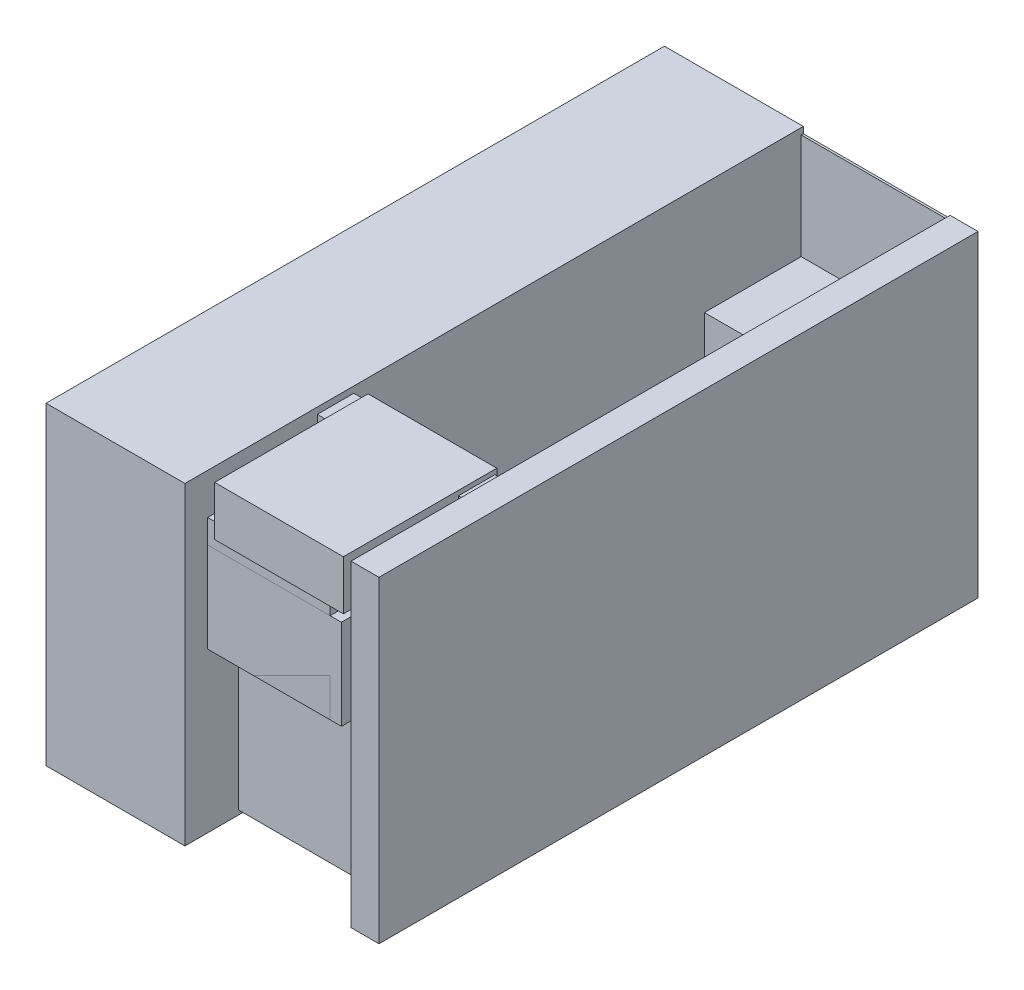
from build123d import *

# Parameters (mm, degrees)
SCHIZZO1_W                        = 700
SCHIZZO1_H                        = 700
ESTRUSIONE_ESTRUSIONE1_DEPTH      = 1130
SCHIZZO2_W                        = 330
SCHIZZO2_H                        = 265
ESTRUSIONE_ESTRUSIONE2_DEPTH      = 255
SCHIZZO3_W                        = 150
SCHIZZO3_H                        = 95
ESTRUSIONE_ESTRUSIONE3_DEPTH      = 210
SCHIZZO5_W                        = 350
SCHIZZO5_H                        = 1040
TAGLIO_ESTRUSIONE1_DEPTH          = 245
SCHIZZO7_W                        = 350
SCHIZZO7_H                        = 465
TAGLIO_ESTRUSIONE2_DEPTH          = 95
SCHIZZO8_W                        = 350
SCHIZZO8_H                        = 350
TAGLIO_ESTRUSIONE3_DEPTH          = 458
SCHIZZO9_W                        = 290
SCHIZZO9_H                        = 225
TAGLIO_ESTRUSIONE5_DEPTH          = 320
ESTRUSIONE_ESTRUSIONE5_DEPTH      = 18
ESTRUSIONE_ESTRUSIONE5_DEPTH_BACK = 305
SCHIZZO10_W                       = 1437.610772049
SCHIZZO10_H                       = 729.839733265
ESTRUSIONE_ESTRUSIONE6_DEPTH      = 11
ESTRUSIONE_ESTRUSIONE6_DEPTH_BACK = 54
SCHIZZO11_W                       = 1392.524009873
SCHIZZO11_H                       = 737.915681111
ESTRUSIONE_ESTRUSIONE7_DEPTH      = 11
ESTRUSIONE_ESTRUSIONE7_DEPTH_BACK = 104
SCHIZZO12_W                       = 299.349754516
SCHIZZO12_H                       = 356.648974915
SCHIZZO15_W                       = 311.967933214
SCHIZZO15_H                       = 209.587453761
ESTRUSIONE_ESTRUSIONE9_DEPTH      = 38
SCHIZZO18_W                       = 282.631025558
SCHIZZO18_H                       = 479.986147738
ESTRUSIONE_ESTRUSIONE11_DEPTH     = 375
SCHIZZO19_W                       = 279.763490261
SCHIZZO19_H                       = 367.953434119
ESTRUSIONE_ESTRUSIONE12_DEPTH     = 287


with BuildPart() as part:
    # Schizzo1 → Estrusione-Estrusione1 (new body)
    with BuildSketch(Plane.XY):
        Rectangle(SCHIZZO1_W, SCHIZZO1_H)
    extrude(amount=ESTRUSIONE_ESTRUSIONE1_DEPTH)

    # Schizzo5 → Taglio-Estrusione1 (cut)
    with BuildSketch(Plane(origin=(0, 350, 0), x_dir=(1, 0, 0), z_dir=(0, 1, 0))):
        with Locations((125, -525)):
            Rectangle(SCHIZZO5_W, SCHIZZO5_H)
    extrude(amount=-TAGLIO_ESTRUSIONE1_DEPTH, mode=Mode.SUBTRACT)

    # Schizzo7 → Taglio-Estrusione2 (cut)
    with BuildSketch(Plane(origin=(0, 105, 0), x_dir=(1, 0, 0), z_dir=(0, 1, 0))):
        with Locations((125, -462.5)):
            Rectangle(SCHIZZO7_W, SCHIZZO7_H)
    extrude(amount=-TAGLIO_ESTRUSIONE2_DEPTH, mode=Mode.SUBTRACT)

    # Schizzo8 → Taglio-Estrusione3 (cut)
    with BuildSketch(Plane(origin=(0, 105, 0), x_dir=(1, 0, 0), z_dir=(0, 1, 0))):
        with Locations((125, -870)):
            Rectangle(SCHIZZO8_W, SCHIZZO8_H)
    extrude(amount=-TAGLIO_ESTRUSIONE3_DEPTH, mode=Mode.SUBTRACT)


with BuildPart() as body_2:
    # Schizzo2 → Estrusione-Estrusione2 (new body)
    with BuildSketch(Plane.XY.offset(1130)):
        with Locations((75, 137.5)):
            Rectangle(SCHIZZO2_W, SCHIZZO2_H)
    extrude(amount=ESTRUSIONE_ESTRUSIONE2_DEPTH)


with BuildPart() as body_3:
    # Schizzo3 → Estrusione-Estrusione3 (new body)
    with BuildSketch(Plane.XY.offset(1130)):
        with Locations((-165, 147.5)):
            Rectangle(SCHIZZO3_W, SCHIZZO3_H)
    extrude(amount=ESTRUSIONE_ESTRUSIONE3_DEPTH)


with BuildPart() as taglio_estrusione5_tool:
    # Schizzo9 → Taglio-Estrusione5 (new body)
    with BuildSketch(Plane(origin=(0, 0, 1045), x_dir=(-1, 0, 0), z_dir=(0, 0, -1))):
        with Locations((-75, 137.5)):
            Rectangle(SCHIZZO9_W, SCHIZZO9_H)
    extrude(amount=-TAGLIO_ESTRUSIONE5_DEPTH)


with BuildPart() as part_1:
    add(part.part)

    # Taglio-Estrusione5: cut by taglio_estrusione5_tool
    add(taglio_estrusione5_tool.part, mode=Mode.SUBTRACT)


with BuildPart() as body_2_1:
    add(body_2.part)

    # Taglio-Estrusione5: cut by taglio_estrusione5_tool
    add(taglio_estrusione5_tool.part, mode=Mode.SUBTRACT)


with BuildPart() as body_4:
    # Schizzo10 → Estrusione-Estrusione5 (new, two sides: drawn at the far end of the back side and taken through both)
    with BuildSketch(Plane.ZY.offset(350).offset(-ESTRUSIONE_ESTRUSIONE5_DEPTH_BACK)):
        with Locations((718.805386025, -0.185507772)):
            Rectangle(SCHIZZO10_W, SCHIZZO10_H)
    extrude(amount=ESTRUSIONE_ESTRUSIONE5_DEPTH + ESTRUSIONE_ESTRUSIONE5_DEPTH_BACK)


with BuildPart() as body_5:
    # Schizzo11 → Estrusione-Estrusione6 (new, two sides: drawn at the far end of the back side and taken through both)
    with BuildSketch(Plane(origin=(350, 0, 0), x_dir=(0, 0, -1), z_dir=(1, 0, 0)).offset(-ESTRUSIONE_ESTRUSIONE6_DEPTH_BACK)):
        with Locations((-696.262004937, -12.690818359)):
            Rectangle(SCHIZZO11_W, SCHIZZO11_H)
    extrude(amount=ESTRUSIONE_ESTRUSIONE6_DEPTH + ESTRUSIONE_ESTRUSIONE6_DEPTH_BACK)


with BuildPart() as body_6:
    # Schizzo12 → Estrusione-Estrusione7 (new, two sides: drawn at the far end of the back side and taken through both)
    with BuildSketch(Plane(origin=(0, 350, 0), x_dir=(1, 0, 0), z_dir=(0, 1, 0)).offset(-ESTRUSIONE_ESTRUSIONE7_DEPTH_BACK)):
        with Locations((133.312866105, -1218.98054727)):
            Rectangle(SCHIZZO12_W, SCHIZZO12_H)
    extrude(amount=ESTRUSIONE_ESTRUSIONE7_DEPTH + ESTRUSIONE_ESTRUSIONE7_DEPTH_BACK)


with BuildPart() as body_7:
    # Schizzo15 → Estrusione-Estrusione9 (new body)
    with BuildSketch(Plane.XY.offset(1385)):
        with Locations((110.12024335, 109.793726881)):
            Rectangle(SCHIZZO15_W, SCHIZZO15_H)
    extrude(amount=-ESTRUSIONE_ESTRUSIONE9_DEPTH)


with BuildPart() as body_8:
    # Schizzo18 → Estrusione-Estrusione11 (new body)
    with BuildSketch(Plane(origin=(0, 10, 0), x_dir=(1, 0, 0), z_dir=(0, 1, 0))):
        with Locations((141.315512779, -469.993073869)):
            Rectangle(SCHIZZO18_W, SCHIZZO18_H)
    extrude(amount=-ESTRUSIONE_ESTRUSIONE11_DEPTH)


with BuildPart() as body_9:
    # Schizzo19 → Estrusione-Estrusione12 (new body)
    with BuildSketch(Plane(origin=(0, 0, 1045), x_dir=(-1, 0, 0), z_dir=(0, 0, -1))):
        with Locations((-113.633396128, -152.001509819)):
            Rectangle(SCHIZZO19_W, SCHIZZO19_H)
    extrude(amount=-ESTRUSIONE_ESTRUSIONE12_DEPTH)


solid = Compound([body_3.part, part_1.part, body_2_1.part, body_4.part, body_5.part, body_6.part, body_7.part, body_8.part, body_9.part])
